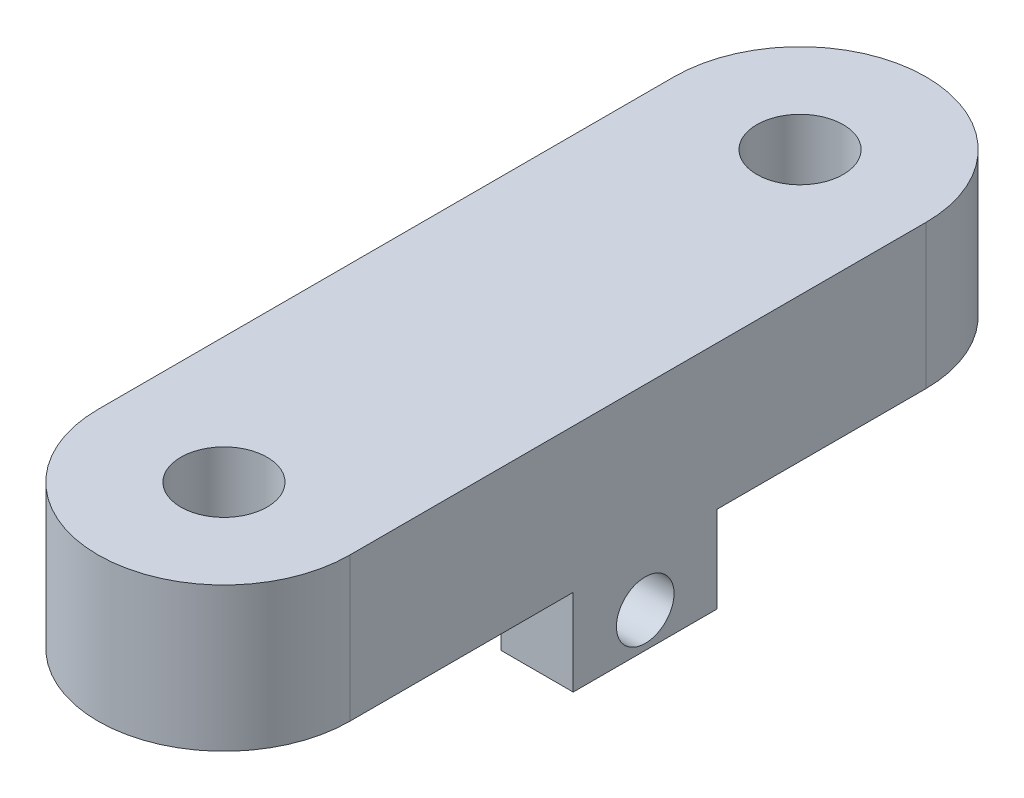
from build123d import *

# Parameters (mm, degrees)
SKETCH1_W             = 5
SKETCH1_H             = 10
BOSS_EXTRUDE1_DEPTH   = 6
BOSS_EXTRUDE1_2_DEPTH = 6
SKETCH2_R             = 2
CUT_EXTRUDE1_DEPTH    = 100
SKETCH4_R             = 3
BOSS_EXTRUDE2_DEPTH   = 10


with BuildPart() as part:
    # Sketch1 → Boss-Extrude1 (new body)
    with BuildSketch(Plane(origin=(0, 0, 0), x_dir=(1, 0, 0), z_dir=(0, 1, 0))):
        with Locations((-15, 5)):
            Rectangle(SKETCH1_W, SKETCH1_H)
    extrude(amount=BOSS_EXTRUDE1_DEPTH)


with BuildPart() as body_2:
    # Sketch1 → Boss-Extrude1 2 (new body)
    with BuildSketch(Plane(origin=(0, 0, 0), x_dir=(1, 0, 0), z_dir=(0, 1, 0))):
        with Locations((-2.5, 5)):
            Rectangle(SKETCH1_W, SKETCH1_H)
    extrude(amount=BOSS_EXTRUDE1_2_DEPTH)


with BuildPart() as cut_extrude1_tool:
    # Sketch2 → Cut-Extrude1 (new body)
    with BuildSketch(Plane(origin=(0, 0, 0), x_dir=(0, 0, -1), z_dir=(1, 0, 0))):
        with Locations((5, 2.43)):
            Circle(SKETCH2_R)
    extrude(amount=-CUT_EXTRUDE1_DEPTH)


with BuildPart() as part_1:
    add(part.part)

    # Cut-Extrude1: cut by cut_extrude1_tool
    add(cut_extrude1_tool.part, mode=Mode.SUBTRACT)



with BuildPart() as body_2_1:
    add(body_2.part)

    # Cut-Extrude1: cut by cut_extrude1_tool
    add(cut_extrude1_tool.part, mode=Mode.SUBTRACT)


with BuildPart() as part_2:
    add(part_1.part)

    add(body_2_1.part)  # Boss-Extrude2 merges body 2
    # Sketch4 → Boss-Extrude2 (add)
    with BuildSketch(Plane(origin=(0, 6, 0), x_dir=(1, 0, 0), z_dir=(0, 1, 0))):
        with BuildLine():
            Line((-17.5, -15.5), (-17.5, 24.5))
            ThreePointArc((-17.5, 24.5), (-8.75, 33.25), (0, 24.5))
            Line((0, 24.5), (0, -15.5))
            ThreePointArc((0, -15.5), (-8.75, -24.25), (-17.5, -15.5))
        make_face()
        with Locations(Location((-8.75, 24.5, 0), (0, 0, 270))):
            Circle(SKETCH4_R, mode=Mode.SUBTRACT)
        with Locations(Location((-8.75, -15.5, 0), (0, 0, 270))):
            Circle(SKETCH4_R, mode=Mode.SUBTRACT)
    extrude(amount=BOSS_EXTRUDE2_DEPTH)


solid = part_2.part
